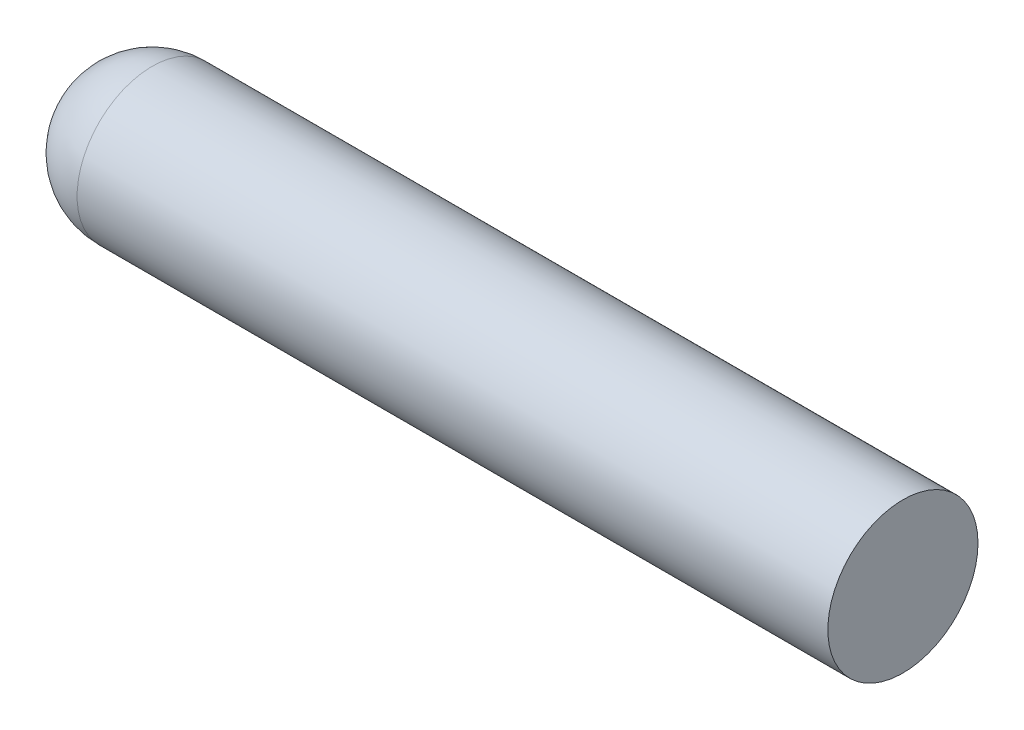
from build123d import *


with BuildPart() as part:
    # Sketch2 → Revolve4 (revolve)
    with BuildSketch(Plane(origin=(0, 0, 0), x_dir=(1, 0, 0), z_dir=(0, 1, 0)), mode=Mode.PRIVATE) as revolve4_sk:
        with BuildLine():
            Line((0, 0), (-25.4, 0))
            ThreePointArc((-25.4, 0), (-27.196051224, 0.743948776), (-27.94, 2.54))
            Line((-27.94, 2.54), (0, 2.54))
            Line((0, 2.54), (0, 0))
        make_face()
    revolve(revolve4_sk.sketch.rotate(Axis((0, 0, -2.54), (-1, 0, 0)), 180), axis=Axis((0, 0, -2.54), (-1, 0, 0)))


solid = part.part
